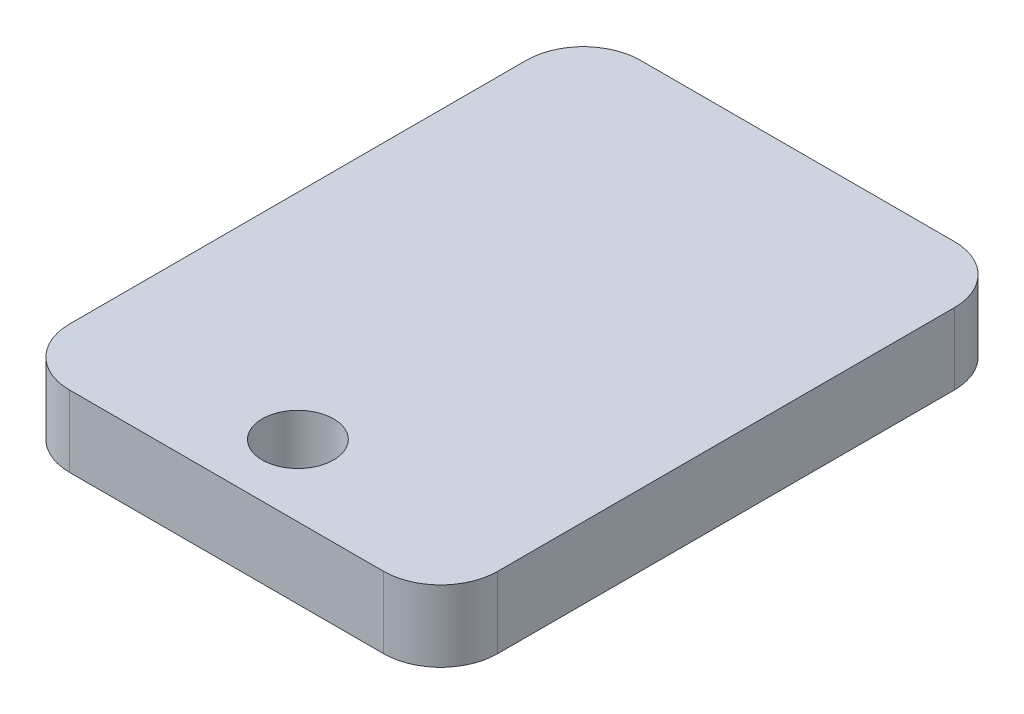
from build123d import *

# Parameters (mm, degrees)
SKETCH2_R           = 3.175
BOSS_EXTRUDE1_DEPTH = 3.175


with BuildPart() as part:
    # Sketch2 → Boss-Extrude1 (new, symmetric)
    with BuildSketch(Plane(origin=(0, 0, 0), x_dir=(1, 0, 0), z_dir=(0, 1, 0))):
        with BuildLine():
            Line((-13.97, -25.4), (13.97, -25.4))
            ThreePointArc((13.97, -25.4), (17.562102448, -23.912102448), (19.05, -20.32))
            Line((19.05, -20.32), (19.05, 20.32))
            ThreePointArc((19.05, 20.32), (17.562102448, 23.912102448), (13.97, 25.4))
            Line((13.97, 25.4), (-13.97, 25.4))
            ThreePointArc((-13.97, 25.4), (-17.562102448, 23.912102448), (-19.05, 20.32))
            Line((-19.05, 20.32), (-19.05, -20.32))
            ThreePointArc((-19.05, -20.32), (-17.562102448, -23.912102448), (-13.97, -25.4))
        make_face()
        with Locations(Location((0, -19.05, 0), (0, 0, 270))):
            Circle(SKETCH2_R, mode=Mode.SUBTRACT)
    extrude(amount=BOSS_EXTRUDE1_DEPTH, both=True)


solid = part.part
